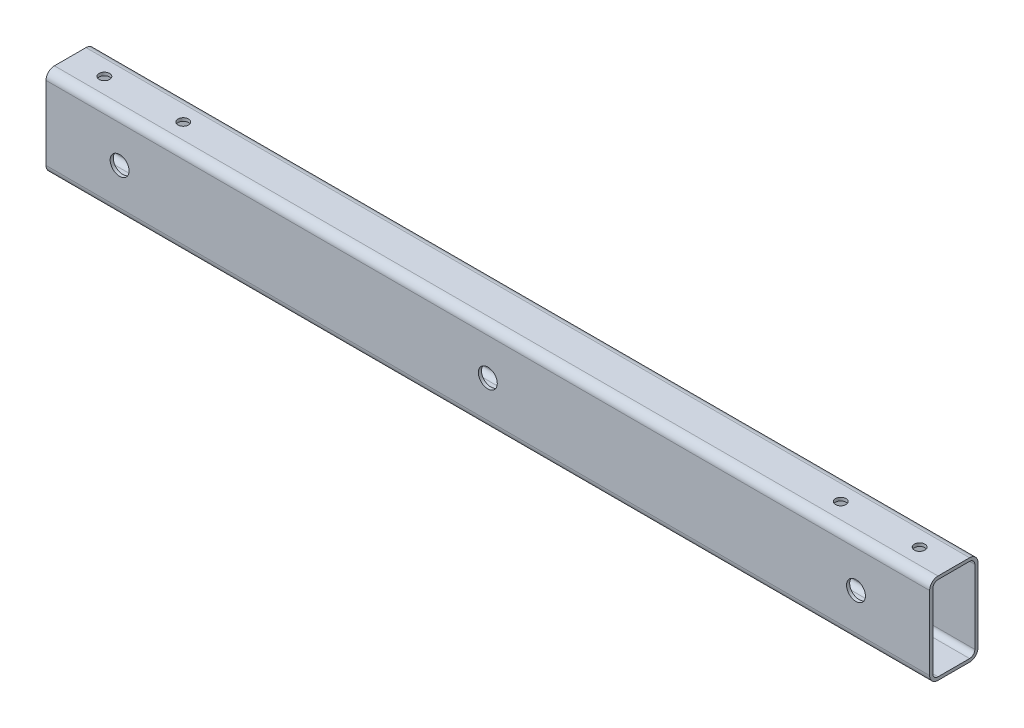
from build123d import *

# Parameters (mm, degrees)
EXTRUDE_THIN1_DEPTH      = 420
EXTRUDE_THIN1_DEPTH_BACK = 420
CUT_EXTRUDE1_DEPTH       = 423.82147533
CUT_EXTRUDE1_DEPTH_BACK  = 423.82147533
SKETCH2_R                = 9
CUT_EXTRUDE2_DEPTH       = 423.82147533
CUT_EXTRUDE2_DEPTH_BACK  = 423.82147533
SKETCH3_R                = 5


with BuildPart() as part:
    # Sketch1 → Extrude-Thin1 (new, two sides: drawn at the far end of the back side and taken through both)
    with BuildSketch(Plane(origin=(0, 0, 0), x_dir=(0, 0, -1), z_dir=(1, 0, 0)).offset(-EXTRUDE_THIN1_DEPTH_BACK)):
        with BuildLine():
            Line((-23, 35), (-23, -35))
            ThreePointArc((-23, -35), (-20.656854249, -40.656854249), (-15, -43))
            Line((-15, -43), (15, -43))
            ThreePointArc((15, -43), (20.656854249, -40.656854249), (23, -35))
            Line((23, -35), (23, 35))
            ThreePointArc((23, 35), (20.656854249, 40.656854249), (15, 43))
            Line((15, 43), (-15, 43))
            ThreePointArc((-15, 43), (-20.656854249, 40.656854249), (-23, 35))
        make_face()
        with BuildLine():
            Line((-20, 35), (-20, -35))
            ThreePointArc((-20, -35), (-18.535533906, -38.535533906), (-15, -40))
            Line((-15, -40), (15, -40))
            ThreePointArc((15, -40), (18.535533906, -38.535533906), (20, -35))
            Line((20, -35), (20, 35))
            ThreePointArc((20, 35), (18.535533906, 38.535533906), (15, 40))
            Line((15, 40), (-15, 40))
            ThreePointArc((-15, 40), (-18.535533906, 38.535533906), (-20, 35))
        make_face(mode=Mode.SUBTRACT)
    extrude(amount=EXTRUDE_THIN1_DEPTH + EXTRUDE_THIN1_DEPTH_BACK)

    # Sketch2 → Cut-Extrude1 (cut, two sides: drawn at the far end of the back side and taken through both)
    with BuildSketch(Plane.XY.offset(-CUT_EXTRUDE1_DEPTH_BACK)):
        Circle(SKETCH2_R)
        with Locations((-350, 0)):
            Circle(SKETCH2_R)
        with Locations(Location((350, 0, 0), (0, 0, 180))):
            Circle(SKETCH2_R)
    extrude(amount=CUT_EXTRUDE1_DEPTH + CUT_EXTRUDE1_DEPTH_BACK, mode=Mode.SUBTRACT)

    # Sketch3 → Cut-Extrude2 (cut, two sides: drawn at the far end of the back side and taken through both)
    with BuildSketch(Plane(origin=(0, 0, 0), x_dir=(1, 0, 0), z_dir=(0, 1, 0)).offset(-CUT_EXTRUDE2_DEPTH_BACK)):
        with Locations(Location((-387.5, 0, 0), (0, 0, 270))):
            Circle(SKETCH3_R)
        with Locations(Location((-312.5, 0, 0), (0, 0, 270))):
            Circle(SKETCH3_R)
        with Locations(Location((312.5, 0, 0), (0, 0, 90))):
            Circle(SKETCH3_R)
        with Locations(Location((387.5, 0, 0), (0, 0, 90))):
            Circle(SKETCH3_R)
    extrude(amount=CUT_EXTRUDE2_DEPTH + CUT_EXTRUDE2_DEPTH_BACK, mode=Mode.SUBTRACT)


solid = part.part
